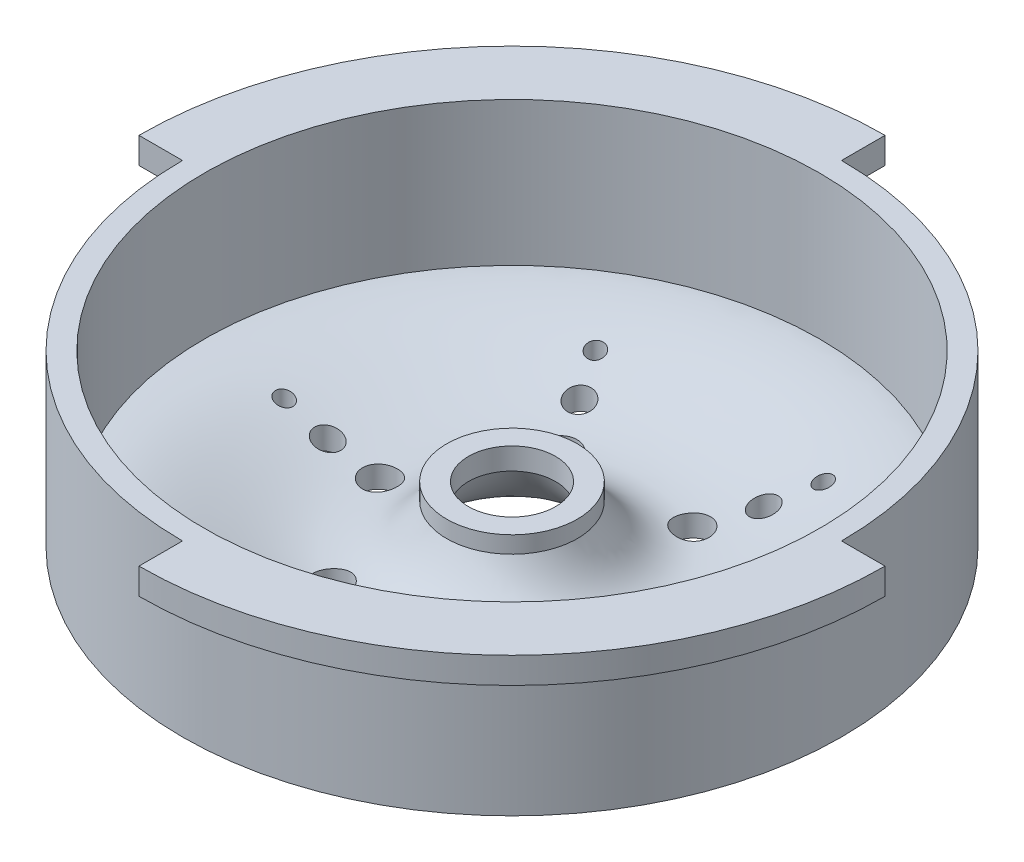
from build123d import *

# Parameters (mm, degrees)
SKETCH3_R           = 5.08
SKETCH3_R_2         = 3.81
SKETCH3_R_3         = 2.54
CUT_EXTRUDE2_DEPTH  = 140.831475676
BOSS_EXTRUDE1_START = -7.62
BOSS_EXTRUDE1_DEPTH = 7.62


with BuildPart() as part:
    # Sketch1 → Revolve1 (revolve)
    with BuildSketch(Plane.XY, mode=Mode.PRIVATE) as revolve1_sk:
        with BuildLine():
            add(Edge.make_bspline(
                [(-12.7, 9.24721005), (-24.416328648, -16.258579913), (-56.93007551, -6.472280091), (-84.351488378, 2.467766002), (-96.079449289, -0.91278995)],
                knots=[0, 0, 0, 0, 0.639697831, 1, 1, 1, 1], degree=3))
            Line((-12.7, 9.24721005), (-12.7, 15.59721005))
            Line((-12.7, 15.59721005), (-19.05, 15.59721005))
            Line((-19.05, 15.59721005), (-19.05, 10.682000451))
            add(Edge.make_bspline(
                [(-19.05, 10.682000451), (-19.279544478, 10.218227392), (-19.764489627, 9.281404239), (-20.728000972, 7.583465166), (-21.965084096, 5.683024574), (-23.472708958, 3.76032845), (-25.507424661, 1.618140601), (-28.082697837, -0.357919575), (-31.301331809, -1.899370311), (-34.803124236, -2.791471766), (-39.973105039, -3.201177952), (-47.357596025, -2.316568508), (-57.123167872, 0.35570738), (-65.443068695, 3.109536755), (-72.39749687, 5.090437293), (-77.855227256, 6.270900313), (-82.657068011, 6.826498813), (-86.641226757, 6.902558164), (-88.708916131, 6.79712921), (-89.729449289, 6.70721005)],
                knots=[0.011824265, 0.011824265, 0.011824265, 0.011824265, 0.026126338, 0.04042841, 0.069032555, 0.0976367, 0.126240844, 0.183449134, 0.240657424, 0.297865713, 0.355074003, 0.469490582, 0.583907161, 0.69832374, 0.755532029, 0.812740319, 0.869948609, 0.898552753, 0.927156898, 0.927156898, 0.927156898, 0.927156898], degree=3))
            Line((-89.729449289, 6.70721005), (-89.729449289, 40.99721005))
            Line((-89.729449289, 40.99721005), (-89.729449289, 48.61721005))
            Line((-89.729449289, 48.61721005), (-96.079449289, 48.61721005))
            Line((-96.079449289, 48.61721005), (-96.079449289, -0.91278995))
        make_face()
    revolve(revolve1_sk.sketch.rotate(Axis((0, 0, 0), (0, 1, 0)), 270), axis=Axis((0, 0, 0), (0, 1, 0)))

    # Sketch3 → Cut-Extrude2 (cut, through all)
    with BuildSketch(Plane(origin=(0, 15.59721005, 0), x_dir=(1, 0, 0), z_dir=(0, 1, 0))):
        with Locations(Location((38.490008599, 0, 0), (0, 0, 270))):
            Circle(SKETCH3_R)
        with Locations(Location((53.730008599, 0, 0), (0, 0, 270))):
            Circle(SKETCH3_R_2)
        with Locations(Location((66.430008599, 0, 0), (0, 0, 270))):
            Circle(SKETCH3_R_3)
        with Locations(Location((19.245004299, -33.333325238, 0), (0, 0, 270))):
            Circle(SKETCH3_R)
        with Locations(Location((26.865004299, -46.531552392, 0), (0, 0, 270))):
            Circle(SKETCH3_R_2)
        with Locations(Location((33.215004299, -57.53007502, 0), (0, 0, 270))):
            Circle(SKETCH3_R_3)
        with Locations(Location((-19.245004299, -33.333325238, 0), (0, 0, 270))):
            Circle(SKETCH3_R)
        with Locations(Location((-26.865004299, -46.531552392, 0), (0, 0, 270))):
            Circle(SKETCH3_R_2)
        with Locations(Location((-33.215004299, -57.53007502, 0), (0, 0, 270))):
            Circle(SKETCH3_R_3)
        with Locations((-38.490008599, 0)):
            Circle(SKETCH3_R)
        with Locations((-53.730008599, 0)):
            Circle(SKETCH3_R_2)
        with Locations((-66.430008599, 0)):
            Circle(SKETCH3_R_3)
        with Locations(Location((-19.245004299, 33.333325238, 0), (0, 0, 270))):
            Circle(SKETCH3_R)
        with Locations(Location((-26.865004299, 46.531552392, 0), (0, 0, 270))):
            Circle(SKETCH3_R_2)
        with Locations(Location((-33.215004299, 57.53007502, 0), (0, 0, 270))):
            Circle(SKETCH3_R_3)
        with Locations(Location((19.245004299, 33.333325238, 0), (0, 0, 270))):
            Circle(SKETCH3_R)
        with Locations(Location((26.865004299, 46.531552392, 0), (0, 0, 270))):
            Circle(SKETCH3_R_2)
        with Locations(Location((33.215004299, 57.53007502, 0), (0, 0, 270))):
            Circle(SKETCH3_R_3)
    extrude(amount=-CUT_EXTRUDE2_DEPTH, mode=Mode.SUBTRACT)

    # Sketch6 → Boss-Extrude1 (add)
    with BuildSketch(Plane(origin=(0, 48.61721005, 0), x_dir=(1, 0, 0), z_dir=(0, 1, 0)).offset(BOSS_EXTRUDE1_START)):
        with BuildLine():
            Line((0, 96.079449289), (0, 108.779449289))
            ThreePointArc((0, 108.779449289), (-76.918686246, 76.918686246), (-108.779449289, 0))
            Line((-108.779449289, 0), (-96.079449289, 0))
            ThreePointArc((-96.079449289, 0), (-67.938430125, 67.938430125), (0, 96.079449289))
        make_face()
        with BuildLine():
            Line((96.079449289, 0), (108.779449289, 0))
            ThreePointArc((108.779449289, 0), (76.918686246, -76.918686246), (0, -108.779449289))
            Line((0, -108.779449289), (0, -96.079449289))
            ThreePointArc((0, -96.079449289), (67.938430125, -67.938430125), (96.079449289, 0))
        make_face()
    extrude(amount=BOSS_EXTRUDE1_DEPTH)


solid = part.part
